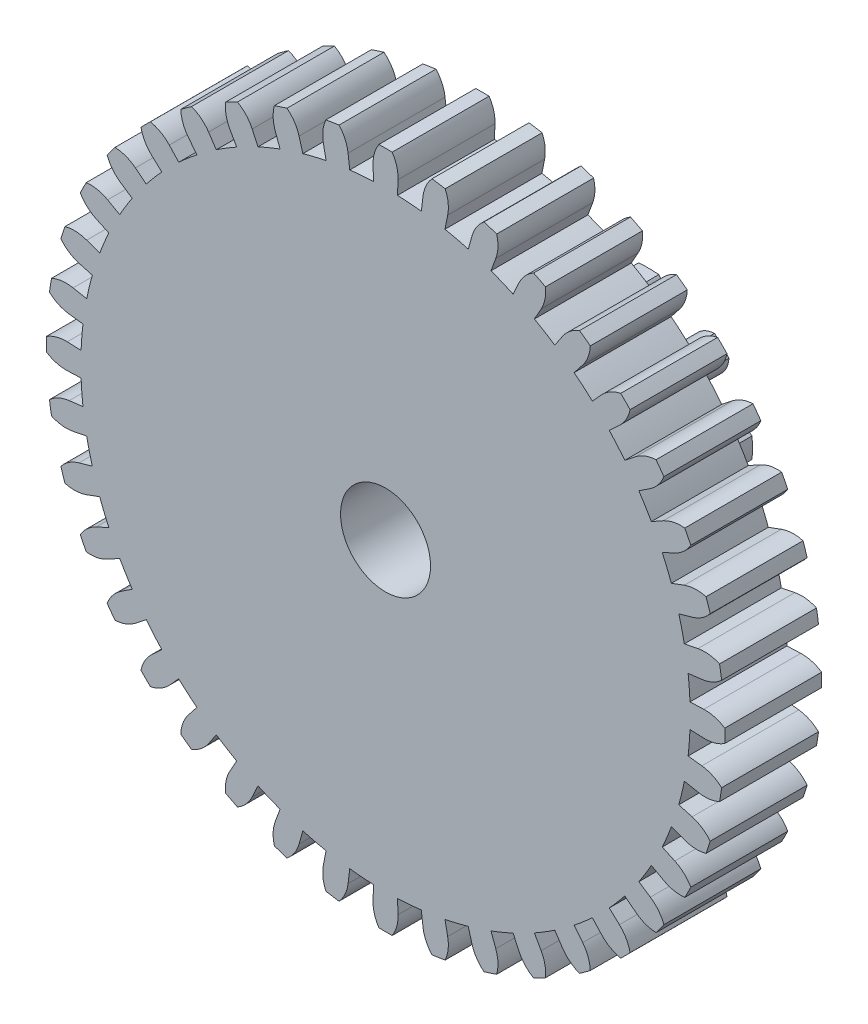
from build123d import *

# Parameters (mm, degrees)
BOSS_EXTRUDE1_DEPTH = 1.4
BOSS_EXTRUDE2_DEPTH = 2.4
SKETCH4_R           = 0.65
CUT_EXTRUDE1_DEPTH  = 10


with BuildPart() as part:
    # Sketch1 → Boss-Extrude1 (new body)
    with BuildSketch(Plane.XY):
        with BuildLine():
            Line((4.396607759, 0.172743189), (4.596453567, 0.180595152))
            ThreePointArc((4.596453567, 0.180595152), (4.754374462, 0.162137592), (4.899055478, 0.096205093))
            ThreePointArc((4.899055478, 0.096205093), (4.9, 0), (4.899055478, -0.096205093))
            ThreePointArc((4.899055478, -0.096205093), (4.754374462, -0.162137592), (4.596453567, -0.180595152))
            Line((4.596453567, -0.180595152), (4.396607759, -0.172743189))
            ThreePointArc((4.396607759, -0.172743189), (4.392368685, -0.259031536), (4.386436268, -0.345220021))
            ThreePointArc((4.386436268, -0.345220021), (4.378812797, -0.431275417), (4.369501211, -0.517164549))
            Line((4.369501211, -0.517164549), (4.568114902, -0.540672028))
            ThreePointArc((4.568114902, -0.540672028), (4.721204131, -0.583606617), (4.853789768, -0.671360474))
            ThreePointArc((4.853789768, -0.671360474), (4.839672869, -0.766528879), (4.823690184, -0.861401772))
            ThreePointArc((4.823690184, -0.861401772), (4.670476316, -0.903889435), (4.51161229, -0.897415481))
            Line((4.51161229, -0.897415481), (4.315455234, -0.858397417))
            ThreePointArc((4.315455234, -0.858397417), (4.297769878, -0.942960273), (4.27842765, -1.027159601))
            ThreePointArc((4.27842765, -1.027159601), (4.257436006, -1.110962939), (4.23480304, -1.194337979))
            Line((4.23480304, -1.194337979), (4.427294088, -1.248626069))
            ThreePointArc((4.427294088, -1.248626069), (4.571782085, -1.314980493), (4.689007645, -1.422394919))
            ThreePointArc((4.689007645, -1.422394919), (4.66017693, -1.514183272), (4.629549628, -1.60538788))
            ThreePointArc((4.629549628, -1.60538788), (4.471575542, -1.62338452), (4.315680145, -1.592138463))
            Line((4.315680145, -1.592138463), (4.128041878, -1.522915051))
            ThreePointArc((4.128041878, -1.522915051), (4.097345713, -1.603670199), (4.065069943, -1.683807102))
            ThreePointArc((4.065069943, -1.683807102), (4.031227011, -1.763294866), (3.995829965, -1.842102845))
            Line((3.995829965, -1.842102845), (4.1774586, -1.925834793))
            ThreePointArc((4.1774586, -1.925834793), (4.309787591, -2.013975186), (4.408766592, -2.138405279))
            ThreePointArc((4.408766592, -2.138405279), (4.365931969, -2.224553449), (4.321414195, -2.30984401))
            ThreePointArc((4.321414195, -2.30984401), (4.162569738, -2.30290649), (4.013481633, -2.247657711))
            Line((4.013481633, -2.247657711), (3.838982431, -2.149933463))
            ThreePointArc((3.838982431, -2.149933463), (3.796031298, -2.224892443), (3.751616723, -2.298993685))
            ThreePointArc((3.751616723, -2.298993685), (3.705755828, -2.372208621), (3.658466294, -2.444509025))
            Line((3.658466294, -2.444509025), (3.824760217, -2.555623072))
            ThreePointArc((3.824760217, -2.555623072), (3.941671823, -2.663379126), (4.019967073, -2.801761005))
            ThreePointArc((4.019967073, -2.801761005), (3.964183272, -2.880147736), (3.906871203, -2.957424116))
            ThreePointArc((3.906871203, -2.957424116), (3.751067652, -2.92572326), (3.612457882, -2.847832167))
            Line((3.612457882, -2.847832167), (3.455394496, -2.724013377))
            ThreePointArc((3.455394496, -2.724013377), (3.401245995, -2.79133045), (3.345786249, -2.857571413))
            ThreePointArc((3.345786249, -2.857571413), (3.289036638, -2.922710727), (3.231019042, -2.98672328))
            Line((3.231019042, -2.98672328), (3.377883543, -3.122483429))
            ThreePointArc((3.377883543, -3.122483429), (3.476499013, -3.247201832), (3.532182624, -3.396128076))
            ThreePointArc((3.532182624, -3.396128076), (3.464823228, -3.464823228), (3.396128076, -3.532182624))
            ThreePointArc((3.396128076, -3.532182624), (3.247201832, -3.476499013), (3.122483429, -3.377883543))
            Line((3.122483429, -3.377883543), (2.98672328, -3.231019042))
            ThreePointArc((2.98672328, -3.231019042), (2.922710727, -3.289036638), (2.857571413, -3.345786249))
            ThreePointArc((2.857571413, -3.345786249), (2.79133045, -3.401245995), (2.724013377, -3.455394496))
            Line((2.724013377, -3.455394496), (2.847832167, -3.612457882))
            ThreePointArc((2.847832167, -3.612457882), (2.92572326, -3.751067652), (2.957424116, -3.906871203))
            ThreePointArc((2.957424116, -3.906871203), (2.880147736, -3.964183272), (2.801761005, -4.019967073))
            ThreePointArc((2.801761005, -4.019967073), (2.663379126, -3.941671823), (2.555623072, -3.824760217))
            Line((2.555623072, -3.824760217), (2.444509025, -3.658466294))
            ThreePointArc((2.444509025, -3.658466294), (2.372208621, -3.705755828), (2.298993685, -3.751616723))
            ThreePointArc((2.298993685, -3.751616723), (2.224892443, -3.796031298), (2.149933463, -3.838982431))
            Line((2.149933463, -3.838982431), (2.247657711, -4.013481633))
            ThreePointArc((2.247657711, -4.013481633), (2.30290649, -4.162569738), (2.30984401, -4.321414195))
            ThreePointArc((2.30984401, -4.321414195), (2.224553449, -4.365931969), (2.138405279, -4.408766592))
            ThreePointArc((2.138405279, -4.408766592), (2.013975186, -4.309787591), (1.925834793, -4.1774586))
            Line((1.925834793, -4.1774586), (1.842102845, -3.995829965))
            ThreePointArc((1.842102845, -3.995829965), (1.763294866, -4.031227011), (1.683807102, -4.065069943))
            ThreePointArc((1.683807102, -4.065069943), (1.603670199, -4.097345713), (1.522915051, -4.128041878))
            Line((1.522915051, -4.128041878), (1.592138463, -4.315680145))
            ThreePointArc((1.592138463, -4.315680145), (1.62338452, -4.471575542), (1.60538788, -4.629549628))
            ThreePointArc((1.60538788, -4.629549628), (1.514183272, -4.66017693), (1.422394919, -4.689007645))
            ThreePointArc((1.422394919, -4.689007645), (1.314980493, -4.571782085), (1.248626069, -4.427294088))
            Line((1.248626069, -4.427294088), (1.194337979, -4.23480304))
            ThreePointArc((1.194337979, -4.23480304), (1.110962939, -4.257436006), (1.027159601, -4.27842765))
            ThreePointArc((1.027159601, -4.27842765), (0.942960273, -4.297769878), (0.858397417, -4.315455234))
            Line((0.858397417, -4.315455234), (0.897415481, -4.51161229))
            ThreePointArc((0.897415481, -4.51161229), (0.903889435, -4.670476316), (0.861401772, -4.823690184))
            ThreePointArc((0.861401772, -4.823690184), (0.766528879, -4.839672869), (0.671360474, -4.853789768))
            ThreePointArc((0.671360474, -4.853789768), (0.583606617, -4.721204131), (0.540672028, -4.568114902))
            Line((0.540672028, -4.568114902), (0.517164549, -4.369501211))
            ThreePointArc((0.517164549, -4.369501211), (0.431275417, -4.378812797), (0.345220021, -4.386436268))
            ThreePointArc((0.345220021, -4.386436268), (0.259031536, -4.392368685), (0.172743189, -4.396607759))
            Line((0.172743189, -4.396607759), (0.180595152, -4.596453567))
            ThreePointArc((0.180595152, -4.596453567), (0.162137592, -4.754374462), (0.096205093, -4.899055478))
            ThreePointArc((0.096205093, -4.899055478), (0, -4.9), (-0.096205093, -4.899055478))
            ThreePointArc((-0.096205093, -4.899055478), (-0.162137592, -4.754374462), (-0.180595152, -4.596453567))
            Line((-0.180595152, -4.596453567), (-0.172743189, -4.396607759))
            ThreePointArc((-0.172743189, -4.396607759), (-0.259031536, -4.392368685), (-0.345220021, -4.386436268))
            ThreePointArc((-0.345220021, -4.386436268), (-0.431275417, -4.378812797), (-0.517164549, -4.369501211))
            Line((-0.517164549, -4.369501211), (-0.540672028, -4.568114902))
            ThreePointArc((-0.540672028, -4.568114902), (-0.583606617, -4.721204131), (-0.671360474, -4.853789768))
            ThreePointArc((-0.671360474, -4.853789768), (-0.766528879, -4.839672869), (-0.861401772, -4.823690184))
            ThreePointArc((-0.861401772, -4.823690184), (-0.903889435, -4.670476316), (-0.897415481, -4.51161229))
            Line((-0.897415481, -4.51161229), (-0.858397417, -4.315455234))
            ThreePointArc((-0.858397417, -4.315455234), (-0.942960273, -4.297769878), (-1.027159601, -4.27842765))
            ThreePointArc((-1.027159601, -4.27842765), (-1.110962939, -4.257436006), (-1.194337979, -4.23480304))
            Line((-1.194337979, -4.23480304), (-1.248626069, -4.427294088))
            ThreePointArc((-1.248626069, -4.427294088), (-1.314980493, -4.571782085), (-1.422394919, -4.689007645))
            ThreePointArc((-1.422394919, -4.689007645), (-1.514183272, -4.66017693), (-1.60538788, -4.629549628))
            ThreePointArc((-1.60538788, -4.629549628), (-1.62338452, -4.471575542), (-1.592138463, -4.315680145))
            Line((-1.592138463, -4.315680145), (-1.522915051, -4.128041878))
            ThreePointArc((-1.522915051, -4.128041878), (-1.603670199, -4.097345713), (-1.683807102, -4.065069943))
            ThreePointArc((-1.683807102, -4.065069943), (-1.763294866, -4.031227011), (-1.842102845, -3.995829965))
            Line((-1.842102845, -3.995829965), (-1.925834793, -4.1774586))
            ThreePointArc((-1.925834793, -4.1774586), (-2.013975186, -4.309787591), (-2.138405279, -4.408766592))
            ThreePointArc((-2.138405279, -4.408766592), (-2.224553449, -4.365931969), (-2.30984401, -4.321414195))
            ThreePointArc((-2.30984401, -4.321414195), (-2.30290649, -4.162569738), (-2.247657711, -4.013481633))
            Line((-2.247657711, -4.013481633), (-2.149933463, -3.838982431))
            ThreePointArc((-2.149933463, -3.838982431), (-2.224892443, -3.796031298), (-2.298993685, -3.751616723))
            ThreePointArc((-2.298993685, -3.751616723), (-2.372208621, -3.705755828), (-2.444509025, -3.658466294))
            Line((-2.444509025, -3.658466294), (-2.555623072, -3.824760217))
            ThreePointArc((-2.555623072, -3.824760217), (-2.663379126, -3.941671823), (-2.801761005, -4.019967073))
            ThreePointArc((-2.801761005, -4.019967073), (-2.880147736, -3.964183272), (-2.957424116, -3.906871203))
            ThreePointArc((-2.957424116, -3.906871203), (-2.92572326, -3.751067652), (-2.847832167, -3.612457882))
            Line((-2.847832167, -3.612457882), (-2.724013377, -3.455394496))
            ThreePointArc((-2.724013377, -3.455394496), (-2.79133045, -3.401245995), (-2.857571413, -3.345786249))
            ThreePointArc((-2.857571413, -3.345786249), (-2.922710727, -3.289036638), (-2.98672328, -3.231019042))
            Line((-2.98672328, -3.231019042), (-3.122483429, -3.377883543))
            ThreePointArc((-3.122483429, -3.377883543), (-3.247201832, -3.476499013), (-3.396128076, -3.532182624))
            ThreePointArc((-3.396128076, -3.532182624), (-3.464823228, -3.464823228), (-3.532182624, -3.396128076))
            ThreePointArc((-3.532182624, -3.396128076), (-3.476499013, -3.247201832), (-3.377883543, -3.122483429))
            Line((-3.377883543, -3.122483429), (-3.231019042, -2.98672328))
            ThreePointArc((-3.231019042, -2.98672328), (-3.289036638, -2.922710727), (-3.345786249, -2.857571413))
            ThreePointArc((-3.345786249, -2.857571413), (-3.401245995, -2.79133045), (-3.455394496, -2.724013377))
            Line((-3.455394496, -2.724013377), (-3.612457882, -2.847832167))
            ThreePointArc((-3.612457882, -2.847832167), (-3.751067652, -2.92572326), (-3.906871203, -2.957424116))
            ThreePointArc((-3.906871203, -2.957424116), (-3.964183272, -2.880147736), (-4.019967073, -2.801761005))
            ThreePointArc((-4.019967073, -2.801761005), (-3.941671823, -2.663379126), (-3.824760217, -2.555623072))
            Line((-3.824760217, -2.555623072), (-3.658466294, -2.444509025))
            ThreePointArc((-3.658466294, -2.444509025), (-3.705755828, -2.372208621), (-3.751616723, -2.298993685))
            ThreePointArc((-3.751616723, -2.298993685), (-3.796031298, -2.224892443), (-3.838982431, -2.149933463))
            Line((-3.838982431, -2.149933463), (-4.013481633, -2.247657711))
            ThreePointArc((-4.013481633, -2.247657711), (-4.162569738, -2.30290649), (-4.321414195, -2.30984401))
            ThreePointArc((-4.321414195, -2.30984401), (-4.365931969, -2.224553449), (-4.408766592, -2.138405279))
            ThreePointArc((-4.408766592, -2.138405279), (-4.309787591, -2.013975186), (-4.1774586, -1.925834793))
            Line((-4.1774586, -1.925834793), (-3.995829965, -1.842102845))
            ThreePointArc((-3.995829965, -1.842102845), (-4.031227011, -1.763294866), (-4.065069943, -1.683807102))
            ThreePointArc((-4.065069943, -1.683807102), (-4.097345713, -1.603670199), (-4.128041878, -1.522915051))
            Line((-4.128041878, -1.522915051), (-4.315680145, -1.592138463))
            ThreePointArc((-4.315680145, -1.592138463), (-4.471575542, -1.62338452), (-4.629549628, -1.60538788))
            ThreePointArc((-4.629549628, -1.60538788), (-4.66017693, -1.514183272), (-4.689007645, -1.422394919))
            ThreePointArc((-4.689007645, -1.422394919), (-4.571782085, -1.314980493), (-4.427294088, -1.248626069))
            Line((-4.427294088, -1.248626069), (-4.23480304, -1.194337979))
            ThreePointArc((-4.23480304, -1.194337979), (-4.257436006, -1.110962939), (-4.27842765, -1.027159601))
            ThreePointArc((-4.27842765, -1.027159601), (-4.297769878, -0.942960273), (-4.315455234, -0.858397417))
            Line((-4.315455234, -0.858397417), (-4.51161229, -0.897415481))
            ThreePointArc((-4.51161229, -0.897415481), (-4.670476316, -0.903889435), (-4.823690184, -0.861401772))
            ThreePointArc((-4.823690184, -0.861401772), (-4.839672869, -0.766528879), (-4.853789768, -0.671360474))
            ThreePointArc((-4.853789768, -0.671360474), (-4.721204131, -0.583606617), (-4.568114902, -0.540672028))
            Line((-4.568114902, -0.540672028), (-4.369501211, -0.517164549))
            ThreePointArc((-4.369501211, -0.517164549), (-4.378812797, -0.431275417), (-4.386436268, -0.345220021))
            ThreePointArc((-4.386436268, -0.345220021), (-4.392368685, -0.259031536), (-4.396607759, -0.172743189))
            Line((-4.396607759, -0.172743189), (-4.596453567, -0.180595152))
            ThreePointArc((-4.596453567, -0.180595152), (-4.754374462, -0.162137592), (-4.899055478, -0.096205093))
            ThreePointArc((-4.899055478, -0.096205093), (-4.9, 0), (-4.899055478, 0.096205093))
            ThreePointArc((-4.899055478, 0.096205093), (-4.754374462, 0.162137592), (-4.596453567, 0.180595152))
            Line((-4.596453567, 0.180595152), (-4.396607759, 0.172743189))
            ThreePointArc((-4.396607759, 0.172743189), (-4.392368685, 0.259031536), (-4.386436268, 0.345220021))
            ThreePointArc((-4.386436268, 0.345220021), (-4.378812797, 0.431275417), (-4.369501211, 0.517164549))
            Line((-4.369501211, 0.517164549), (-4.568114902, 0.540672028))
            ThreePointArc((-4.568114902, 0.540672028), (-4.721204131, 0.583606617), (-4.853789768, 0.671360474))
            ThreePointArc((-4.853789768, 0.671360474), (-4.839672869, 0.766528879), (-4.823690184, 0.861401772))
            ThreePointArc((-4.823690184, 0.861401772), (-4.670476316, 0.903889435), (-4.51161229, 0.897415481))
            Line((-4.51161229, 0.897415481), (-4.315455234, 0.858397417))
            ThreePointArc((-4.315455234, 0.858397417), (-4.297769878, 0.942960273), (-4.27842765, 1.027159601))
            ThreePointArc((-4.27842765, 1.027159601), (-4.257436006, 1.110962939), (-4.23480304, 1.194337979))
            Line((-4.23480304, 1.194337979), (-4.427294088, 1.248626069))
            ThreePointArc((-4.427294088, 1.248626069), (-4.571782085, 1.314980493), (-4.689007645, 1.422394919))
            ThreePointArc((-4.689007645, 1.422394919), (-4.66017693, 1.514183272), (-4.629549628, 1.60538788))
            ThreePointArc((-4.629549628, 1.60538788), (-4.471575542, 1.62338452), (-4.315680145, 1.592138463))
            Line((-4.315680145, 1.592138463), (-4.128041878, 1.522915051))
            ThreePointArc((-4.128041878, 1.522915051), (-4.097345713, 1.603670199), (-4.065069943, 1.683807102))
            ThreePointArc((-4.065069943, 1.683807102), (-4.031227011, 1.763294866), (-3.995829965, 1.842102845))
            Line((-3.995829965, 1.842102845), (-4.1774586, 1.925834793))
            ThreePointArc((-4.1774586, 1.925834793), (-4.309787591, 2.013975186), (-4.408766592, 2.138405279))
            ThreePointArc((-4.408766592, 2.138405279), (-4.365931969, 2.224553449), (-4.321414195, 2.30984401))
            ThreePointArc((-4.321414195, 2.30984401), (-4.162569738, 2.30290649), (-4.013481633, 2.247657711))
            Line((-4.013481633, 2.247657711), (-3.838982431, 2.149933463))
            ThreePointArc((-3.838982431, 2.149933463), (-3.796031298, 2.224892443), (-3.751616723, 2.298993685))
            ThreePointArc((-3.751616723, 2.298993685), (-3.705755828, 2.372208621), (-3.658466294, 2.444509025))
            Line((-3.658466294, 2.444509025), (-3.824760217, 2.555623072))
            ThreePointArc((-3.824760217, 2.555623072), (-3.941671823, 2.663379126), (-4.019967073, 2.801761005))
            ThreePointArc((-4.019967073, 2.801761005), (-3.964183272, 2.880147736), (-3.906871203, 2.957424116))
            ThreePointArc((-3.906871203, 2.957424116), (-3.751067652, 2.92572326), (-3.612457882, 2.847832167))
            Line((-3.612457882, 2.847832167), (-3.455394496, 2.724013377))
            ThreePointArc((-3.455394496, 2.724013377), (-3.401245995, 2.79133045), (-3.345786249, 2.857571413))
            ThreePointArc((-3.345786249, 2.857571413), (-3.289036638, 2.922710727), (-3.231019042, 2.98672328))
            Line((-3.231019042, 2.98672328), (-3.377883543, 3.122483429))
            ThreePointArc((-3.377883543, 3.122483429), (-3.476499013, 3.247201832), (-3.532182624, 3.396128076))
            ThreePointArc((-3.532182624, 3.396128076), (-3.464823228, 3.464823228), (-3.396128076, 3.532182624))
            ThreePointArc((-3.396128076, 3.532182624), (-3.247201832, 3.476499013), (-3.122483429, 3.377883543))
            Line((-3.122483429, 3.377883543), (-2.98672328, 3.231019042))
            ThreePointArc((-2.98672328, 3.231019042), (-2.922710727, 3.289036638), (-2.857571413, 3.345786249))
            ThreePointArc((-2.857571413, 3.345786249), (-2.79133045, 3.401245995), (-2.724013377, 3.455394496))
            Line((-2.724013377, 3.455394496), (-2.847832167, 3.612457882))
            ThreePointArc((-2.847832167, 3.612457882), (-2.92572326, 3.751067652), (-2.957424116, 3.906871203))
            ThreePointArc((-2.957424116, 3.906871203), (-2.880147736, 3.964183272), (-2.801761005, 4.019967073))
            ThreePointArc((-2.801761005, 4.019967073), (-2.663379126, 3.941671823), (-2.555623072, 3.824760217))
            Line((-2.555623072, 3.824760217), (-2.444509025, 3.658466294))
            ThreePointArc((-2.444509025, 3.658466294), (-2.372208621, 3.705755828), (-2.298993685, 3.751616723))
            ThreePointArc((-2.298993685, 3.751616723), (-2.224892443, 3.796031298), (-2.149933463, 3.838982431))
            Line((-2.149933463, 3.838982431), (-2.247657711, 4.013481633))
            ThreePointArc((-2.247657711, 4.013481633), (-2.30290649, 4.162569738), (-2.30984401, 4.321414195))
            ThreePointArc((-2.30984401, 4.321414195), (-2.224553449, 4.365931969), (-2.138405279, 4.408766592))
            ThreePointArc((-2.138405279, 4.408766592), (-2.013975186, 4.309787591), (-1.925834793, 4.1774586))
            Line((-1.925834793, 4.1774586), (-1.842102845, 3.995829965))
            ThreePointArc((-1.842102845, 3.995829965), (-1.763294866, 4.031227011), (-1.683807102, 4.065069943))
            ThreePointArc((-1.683807102, 4.065069943), (-1.603670199, 4.097345713), (-1.522915051, 4.128041878))
            Line((-1.522915051, 4.128041878), (-1.592138463, 4.315680145))
            ThreePointArc((-1.592138463, 4.315680145), (-1.62338452, 4.471575542), (-1.60538788, 4.629549628))
            ThreePointArc((-1.60538788, 4.629549628), (-1.514183272, 4.66017693), (-1.422394919, 4.689007645))
            ThreePointArc((-1.422394919, 4.689007645), (-1.314980493, 4.571782085), (-1.248626069, 4.427294088))
            Line((-1.248626069, 4.427294088), (-1.194337979, 4.23480304))
            ThreePointArc((-1.194337979, 4.23480304), (-1.110962939, 4.257436006), (-1.027159601, 4.27842765))
            ThreePointArc((-1.027159601, 4.27842765), (-0.942960273, 4.297769878), (-0.858397417, 4.315455234))
            Line((-0.858397417, 4.315455234), (-0.897415481, 4.51161229))
            ThreePointArc((-0.897415481, 4.51161229), (-0.903889435, 4.670476316), (-0.861401772, 4.823690184))
            ThreePointArc((-0.861401772, 4.823690184), (-0.766528879, 4.839672869), (-0.671360474, 4.853789768))
            ThreePointArc((-0.671360474, 4.853789768), (-0.583606617, 4.721204131), (-0.540672028, 4.568114902))
            Line((-0.540672028, 4.568114902), (-0.517164549, 4.369501211))
            ThreePointArc((-0.517164549, 4.369501211), (-0.431275417, 4.378812797), (-0.345220021, 4.386436268))
            ThreePointArc((-0.345220021, 4.386436268), (-0.259031536, 4.392368685), (-0.172743189, 4.396607759))
            Line((-0.172743189, 4.396607759), (-0.180595152, 4.596453567))
            ThreePointArc((-0.180595152, 4.596453567), (-0.162137592, 4.754374462), (-0.096205093, 4.899055478))
            ThreePointArc((-0.096205093, 4.899055478), (0, 4.9), (0.096205093, 4.899055478))
            ThreePointArc((0.096205093, 4.899055478), (0.162137592, 4.754374462), (0.180595152, 4.596453567))
            Line((0.180595152, 4.596453567), (0.172743189, 4.396607759))
            ThreePointArc((0.172743189, 4.396607759), (0.259031536, 4.392368685), (0.345220021, 4.386436268))
            ThreePointArc((0.345220021, 4.386436268), (0.431275417, 4.378812797), (0.517164549, 4.369501211))
            Line((0.517164549, 4.369501211), (0.540672028, 4.568114902))
            ThreePointArc((0.540672028, 4.568114902), (0.583606617, 4.721204131), (0.671360474, 4.853789768))
            ThreePointArc((0.671360474, 4.853789768), (0.766528879, 4.839672869), (0.861401772, 4.823690184))
            ThreePointArc((0.861401772, 4.823690184), (0.903889435, 4.670476316), (0.897415481, 4.51161229))
            Line((0.897415481, 4.51161229), (0.858397417, 4.315455234))
            ThreePointArc((0.858397417, 4.315455234), (0.942960273, 4.297769878), (1.027159601, 4.27842765))
            ThreePointArc((1.027159601, 4.27842765), (1.110962939, 4.257436006), (1.194337979, 4.23480304))
            Line((1.194337979, 4.23480304), (1.248626069, 4.427294088))
            ThreePointArc((1.248626069, 4.427294088), (1.314980493, 4.571782085), (1.422394919, 4.689007645))
            ThreePointArc((1.422394919, 4.689007645), (1.514183272, 4.66017693), (1.60538788, 4.629549628))
            ThreePointArc((1.60538788, 4.629549628), (1.62338452, 4.471575542), (1.592138463, 4.315680145))
            Line((1.592138463, 4.315680145), (1.522915051, 4.128041878))
            ThreePointArc((1.522915051, 4.128041878), (1.603670199, 4.097345713), (1.683807102, 4.065069943))
            ThreePointArc((1.683807102, 4.065069943), (1.763294866, 4.031227011), (1.842102845, 3.995829965))
            Line((1.842102845, 3.995829965), (1.925834793, 4.1774586))
            ThreePointArc((1.925834793, 4.1774586), (2.013975186, 4.309787591), (2.138405279, 4.408766592))
            ThreePointArc((2.138405279, 4.408766592), (2.224553449, 4.365931969), (2.30984401, 4.321414195))
            ThreePointArc((2.30984401, 4.321414195), (2.30290649, 4.162569738), (2.247657711, 4.013481633))
            Line((2.247657711, 4.013481633), (2.149933463, 3.838982431))
            ThreePointArc((2.149933463, 3.838982431), (2.224892443, 3.796031298), (2.298993685, 3.751616723))
            ThreePointArc((2.298993685, 3.751616723), (2.372208621, 3.705755828), (2.444509025, 3.658466294))
            Line((2.444509025, 3.658466294), (2.555623072, 3.824760217))
            ThreePointArc((2.555623072, 3.824760217), (2.663379126, 3.941671823), (2.801761005, 4.019967073))
            ThreePointArc((2.801761005, 4.019967073), (2.880147736, 3.964183272), (2.957424116, 3.906871203))
            ThreePointArc((2.957424116, 3.906871203), (2.92572326, 3.751067652), (2.847832167, 3.612457882))
            Line((2.847832167, 3.612457882), (2.724013377, 3.455394496))
            ThreePointArc((2.724013377, 3.455394496), (2.79133045, 3.401245995), (2.857571413, 3.345786249))
            ThreePointArc((2.857571413, 3.345786249), (2.922710727, 3.289036638), (2.98672328, 3.231019042))
            Line((2.98672328, 3.231019042), (3.122483429, 3.377883543))
            ThreePointArc((3.122483429, 3.377883543), (3.247201832, 3.476499013), (3.396128076, 3.532182624))
            ThreePointArc((3.396128076, 3.532182624), (3.464823228, 3.464823228), (3.532182624, 3.396128076))
            ThreePointArc((3.532182624, 3.396128076), (3.476499013, 3.247201832), (3.377883543, 3.122483429))
            Line((3.377883543, 3.122483429), (3.231019042, 2.98672328))
            ThreePointArc((3.231019042, 2.98672328), (3.289036638, 2.922710727), (3.345786249, 2.857571413))
            ThreePointArc((3.345786249, 2.857571413), (3.401245995, 2.79133045), (3.455394496, 2.724013377))
            Line((3.455394496, 2.724013377), (3.612457882, 2.847832167))
            ThreePointArc((3.612457882, 2.847832167), (3.751067652, 2.92572326), (3.906871203, 2.957424116))
            ThreePointArc((3.906871203, 2.957424116), (3.964183272, 2.880147736), (4.019967073, 2.801761005))
            ThreePointArc((4.019967073, 2.801761005), (3.941671823, 2.663379126), (3.824760217, 2.555623072))
            Line((3.824760217, 2.555623072), (3.658466294, 2.444509025))
            ThreePointArc((3.658466294, 2.444509025), (3.705755828, 2.372208621), (3.751616723, 2.298993685))
            ThreePointArc((3.751616723, 2.298993685), (3.796031298, 2.224892443), (3.838982431, 2.149933463))
            Line((3.838982431, 2.149933463), (4.013481633, 2.247657711))
            ThreePointArc((4.013481633, 2.247657711), (4.162569738, 2.30290649), (4.321414195, 2.30984401))
            ThreePointArc((4.321414195, 2.30984401), (4.365931969, 2.224553449), (4.408766592, 2.138405279))
            ThreePointArc((4.408766592, 2.138405279), (4.309787591, 2.013975186), (4.1774586, 1.925834793))
            Line((4.1774586, 1.925834793), (3.995829965, 1.842102845))
            ThreePointArc((3.995829965, 1.842102845), (4.031227011, 1.763294866), (4.065069943, 1.683807102))
            ThreePointArc((4.065069943, 1.683807102), (4.097345713, 1.603670199), (4.128041878, 1.522915051))
            Line((4.128041878, 1.522915051), (4.315680145, 1.592138463))
            ThreePointArc((4.315680145, 1.592138463), (4.471575542, 1.62338452), (4.629549628, 1.60538788))
            ThreePointArc((4.629549628, 1.60538788), (4.66017693, 1.514183272), (4.689007645, 1.422394919))
            ThreePointArc((4.689007645, 1.422394919), (4.571782085, 1.314980493), (4.427294088, 1.248626069))
            Line((4.427294088, 1.248626069), (4.23480304, 1.194337979))
            ThreePointArc((4.23480304, 1.194337979), (4.257436006, 1.110962939), (4.27842765, 1.027159601))
            ThreePointArc((4.27842765, 1.027159601), (4.297769878, 0.942960273), (4.315455234, 0.858397417))
            Line((4.315455234, 0.858397417), (4.51161229, 0.897415481))
            ThreePointArc((4.51161229, 0.897415481), (4.670476316, 0.903889435), (4.823690184, 0.861401772))
            ThreePointArc((4.823690184, 0.861401772), (4.839672869, 0.766528879), (4.853789768, 0.671360474))
            ThreePointArc((4.853789768, 0.671360474), (4.721204131, 0.583606617), (4.568114902, 0.540672028))
            Line((4.568114902, 0.540672028), (4.369501211, 0.517164549))
            ThreePointArc((4.369501211, 0.517164549), (4.378812797, 0.431275417), (4.386436268, 0.345220021))
            ThreePointArc((4.386436268, 0.345220021), (4.392368685, 0.259031536), (4.396607759, 0.172743189))
        make_face()
    extrude(amount=BOSS_EXTRUDE1_DEPTH)

    # Sketch3 → Boss-Extrude2 (add)
    with BuildSketch(Plane.XY):
        with BuildLine():
            Line((0.98078528, 0.195090322), (1.176942336, 0.234108386))
            ThreePointArc((1.176942336, 0.234108386), (1.345178418, 0.227991318), (1.49277709, 0.14702571))
            ThreePointArc((1.49277709, 0.14702571), (1.5, 0), (1.49277709, -0.14702571))
            ThreePointArc((1.49277709, -0.14702571), (1.345178418, -0.227991318), (1.176942336, -0.234108386))
            Line((1.176942336, -0.234108386), (0.98078528, -0.195090322))
            ThreePointArc((0.98078528, -0.195090322), (0.956940336, -0.290284677), (0.923879533, -0.382683432))
            ThreePointArc((0.923879533, -0.382683432), (0.881921264, -0.471396737), (0.831469612, -0.555570233))
            Line((0.831469612, -0.555570233), (0.997763535, -0.66668428))
            ThreePointArc((0.997763535, -0.66668428), (1.112398988, -0.789970574), (1.15951568, -0.951589926))
            ThreePointArc((1.15951568, -0.951589926), (1.060660172, -1.060660172), (0.951589926, -1.15951568))
            ThreePointArc((0.951589926, -1.15951568), (0.789970574, -1.112398988), (0.66668428, -0.997763535))
            Line((0.66668428, -0.997763535), (0.555570233, -0.831469612))
            ThreePointArc((0.555570233, -0.831469612), (0.471396737, -0.881921264), (0.382683432, -0.923879533))
            ThreePointArc((0.382683432, -0.923879533), (0.290284677, -0.956940336), (0.195090322, -0.98078528))
            Line((0.195090322, -0.98078528), (0.234108386, -1.176942336))
            ThreePointArc((0.234108386, -1.176942336), (0.227991318, -1.345178418), (0.14702571, -1.49277709))
            ThreePointArc((0.14702571, -1.49277709), (0, -1.5), (-0.14702571, -1.49277709))
            ThreePointArc((-0.14702571, -1.49277709), (-0.227991318, -1.345178418), (-0.234108386, -1.176942336))
            Line((-0.234108386, -1.176942336), (-0.195090322, -0.98078528))
            ThreePointArc((-0.195090322, -0.98078528), (-0.290284677, -0.956940336), (-0.382683432, -0.923879533))
            ThreePointArc((-0.382683432, -0.923879533), (-0.471396737, -0.881921264), (-0.555570233, -0.831469612))
            Line((-0.555570233, -0.831469612), (-0.66668428, -0.997763535))
            ThreePointArc((-0.66668428, -0.997763535), (-0.789970574, -1.112398988), (-0.951589926, -1.15951568))
            ThreePointArc((-0.951589926, -1.15951568), (-1.060660172, -1.060660172), (-1.15951568, -0.951589926))
            ThreePointArc((-1.15951568, -0.951589926), (-1.112398988, -0.789970574), (-0.997763535, -0.66668428))
            Line((-0.997763535, -0.66668428), (-0.831469612, -0.555570233))
            ThreePointArc((-0.831469612, -0.555570233), (-0.881921264, -0.471396737), (-0.923879533, -0.382683432))
            ThreePointArc((-0.923879533, -0.382683432), (-0.956940336, -0.290284677), (-0.98078528, -0.195090322))
            Line((-0.98078528, -0.195090322), (-1.176942336, -0.234108386))
            ThreePointArc((-1.176942336, -0.234108386), (-1.345178418, -0.227991318), (-1.49277709, -0.14702571))
            ThreePointArc((-1.49277709, -0.14702571), (-1.5, 0), (-1.49277709, 0.14702571))
            ThreePointArc((-1.49277709, 0.14702571), (-1.345178418, 0.227991318), (-1.176942336, 0.234108386))
            Line((-1.176942336, 0.234108386), (-0.98078528, 0.195090322))
            ThreePointArc((-0.98078528, 0.195090322), (-0.956940336, 0.290284677), (-0.923879533, 0.382683432))
            ThreePointArc((-0.923879533, 0.382683432), (-0.881921264, 0.471396737), (-0.831469612, 0.555570233))
            Line((-0.831469612, 0.555570233), (-0.997763535, 0.66668428))
            ThreePointArc((-0.997763535, 0.66668428), (-1.112398988, 0.789970574), (-1.15951568, 0.951589926))
            ThreePointArc((-1.15951568, 0.951589926), (-1.060660172, 1.060660172), (-0.951589926, 1.15951568))
            ThreePointArc((-0.951589926, 1.15951568), (-0.789970574, 1.112398988), (-0.66668428, 0.997763535))
            Line((-0.66668428, 0.997763535), (-0.555570233, 0.831469612))
            ThreePointArc((-0.555570233, 0.831469612), (-0.471396737, 0.881921264), (-0.382683432, 0.923879533))
            ThreePointArc((-0.382683432, 0.923879533), (-0.290284677, 0.956940336), (-0.195090322, 0.98078528))
            Line((-0.195090322, 0.98078528), (-0.234108386, 1.176942336))
            ThreePointArc((-0.234108386, 1.176942336), (-0.227991318, 1.345178418), (-0.14702571, 1.49277709))
            ThreePointArc((-0.14702571, 1.49277709), (0, 1.5), (0.14702571, 1.49277709))
            ThreePointArc((0.14702571, 1.49277709), (0.227991318, 1.345178418), (0.234108386, 1.176942336))
            Line((0.234108386, 1.176942336), (0.195090322, 0.98078528))
            ThreePointArc((0.195090322, 0.98078528), (0.290284677, 0.956940336), (0.382683432, 0.923879533))
            ThreePointArc((0.382683432, 0.923879533), (0.471396737, 0.881921264), (0.555570233, 0.831469612))
            Line((0.555570233, 0.831469612), (0.66668428, 0.997763535))
            ThreePointArc((0.66668428, 0.997763535), (0.789970574, 1.112398988), (0.951589926, 1.15951568))
            ThreePointArc((0.951589926, 1.15951568), (1.060660172, 1.060660172), (1.15951568, 0.951589926))
            ThreePointArc((1.15951568, 0.951589926), (1.112398988, 0.789970574), (0.997763535, 0.66668428))
            Line((0.997763535, 0.66668428), (0.831469612, 0.555570233))
            ThreePointArc((0.831469612, 0.555570233), (0.881921264, 0.471396737), (0.923879533, 0.382683432))
            ThreePointArc((0.923879533, 0.382683432), (0.956940336, 0.290284677), (0.98078528, 0.195090322))
        make_face()
    extrude(amount=-BOSS_EXTRUDE2_DEPTH)

    # Sketch4 → Cut-Extrude1 (cut)
    with BuildSketch(Plane(origin=(0, 0, -2.4), x_dir=(-1, 0, 0), z_dir=(0, 0, -1))):
        Circle(SKETCH4_R)
    extrude(amount=-CUT_EXTRUDE1_DEPTH, mode=Mode.SUBTRACT)


solid = part.part
